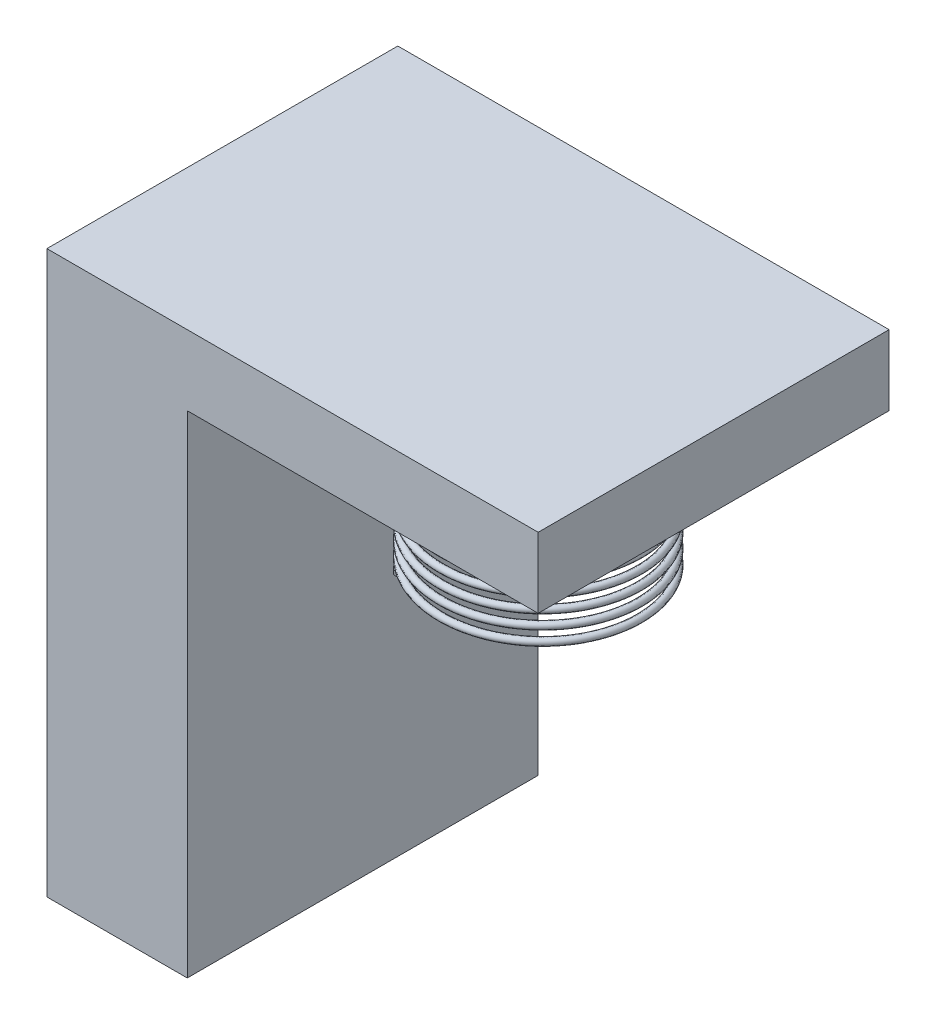
from build123d import *

# Parameters (mm, degrees)
SKETCH1_W           = 20
SKETCH1_H           = 50
BOSS_EXTRUDE1_DEPTH = 80
SKETCH2_W           = 50
SKETCH2_H           = 10
BOSS_EXTRUDE2_DEPTH = 50
SWEEP1_PITCH        = 2
SWEEP1_HEIGHT       = 20
SWEEP1_RADIUS       = 14.095039095
SWEEP1_START_ANGLE  = -135
SWEEP1_PROFILE_R    = 0.5


with BuildPart() as part:
    # Sketch1 → Boss-Extrude1 (new body)
    with BuildSketch(Plane(origin=(0, 0, 0), x_dir=(1, 0, 0), z_dir=(0, 1, 0))):
        Rectangle(SKETCH1_W, SKETCH1_H)
    extrude(amount=BOSS_EXTRUDE1_DEPTH)

    # Sketch2 → Boss-Extrude2 (add)
    with BuildSketch(Plane(origin=(10, 0, 0), x_dir=(0, 0, -1), z_dir=(1, 0, 0))):
        with Locations((0, 75)):
            Rectangle(SKETCH2_W, SKETCH2_H)
    extrude(amount=BOSS_EXTRUDE2_DEPTH)

    # Sweep1: sweep along a helix
    with BuildLine() as sweep1_path:
        add(Helix(SWEEP1_PITCH, SWEEP1_HEIGHT, SWEEP1_RADIUS, center=(35, 70, 0), direction=(0, -1, 0), lefthand=True, mode=Mode.PRIVATE).rotate(Axis((35, 70, 0), (0, -1, 0)), SWEEP1_START_ANGLE))
    # Sweep1 profile (on start of the path) → Sweep1 (sweep)
    with BuildSketch(Plane(origin=(25.033302275, 70, 9.966697725), x_dir=(-0.7071067811865389, 0, 0.7071067811865563), z_dir=(0.7069265389309447, -0.02257735835424111, 0.7069265389309273))):
        Circle(SWEEP1_PROFILE_R)
    sweep(path=sweep1_path.line, is_frenet=True)


solid = part.part
